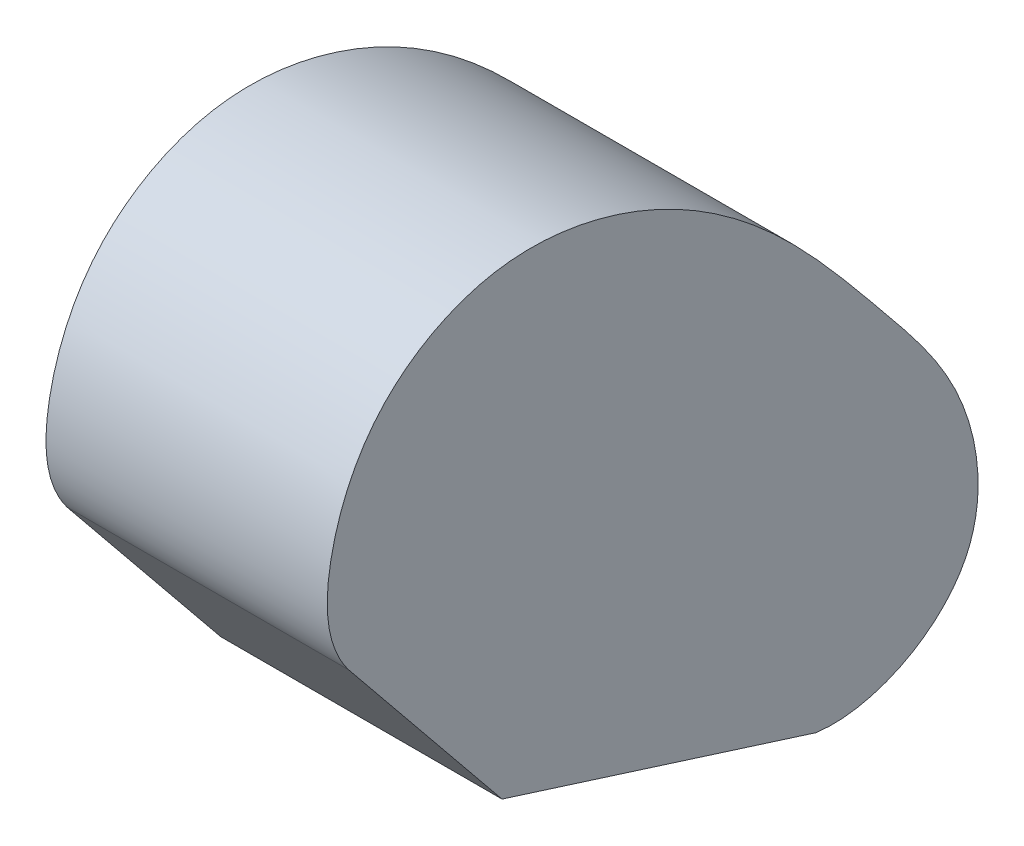
from build123d import *

# Parameters (mm, degrees)
BOSS_EXTRUDE3_DEPTH = 31.75
CUT_EXTRUDE1_DEPTH  = 26.67


with BuildPart() as part:
    # Sketch3 → Boss-Extrude3 (new body)
    with BuildSketch(Plane(origin=(0, 0, 0), x_dir=(0, 0, -1), z_dir=(1, 0, 0))):
        with BuildLine():
            Line((-40.97610675, 27.94), (-5.541970322, 16.71398183))
            add(Edge.make_bspline(
                [(-58.312477556, 49.264351944), (-60.979470459, 52.81331915), (-61.164357979, 61.6455386), (-55.537732377, 74.034432649), (-42.16369512, 81.50596405), (-26.062607722, 79.151326189), (-10.351869297, 69.352421272), (1.104415904, 55.168195736), (12.200560018, 41.689568578), (14.414652135, 22.449660006), (0.938744116, 15.82577004), (-5.541970322, 16.71398183)],
                knots=[0, 0, 0, 0, 0.085903654, 0.177468497, 0.269424522, 0.38307045, 0.497612493, 0.648285366, 0.759107455, 0.86122633, 1, 1, 1, 1], degree=3))
            Line((-58.312477556, 49.264351944), (-40.97610675, 27.94))
        make_face()
    extrude(amount=-BOSS_EXTRUDE3_DEPTH)

    # Sketch4 → Cut-Extrude1 (cut)
    with BuildSketch(Plane.ZY.offset(31.75)):
        with BuildLine():
            Line((51.619537388, 47.838415212), (38.991660301, 30.589789753))
            Line((38.991660301, 30.589789753), (12.82348056, 30.589789753))
            Line((12.82348056, 30.589789753), (12.82348056, 63.410804486))
            add(Edge.make_bspline(
                [(12.82348056, 63.410804486), (16.075524743, 66.305691468), (21.766381335, 70.098645112), (31.247490953, 74.563292025), (41.354678146, 74.490665245), (53.427066999, 66.018283329), (54.350384677, 53.94821484), (51.619537388, 47.838415212)],
                knots=[0.403518168, 0.403518168, 0.403518168, 0.403518168, 0.529247637, 0.602050827, 0.703207049, 0.805208076, 1, 1, 1, 1], degree=3))
        make_face()
    extrude(amount=-CUT_EXTRUDE1_DEPTH, mode=Mode.SUBTRACT)


solid = part.part
